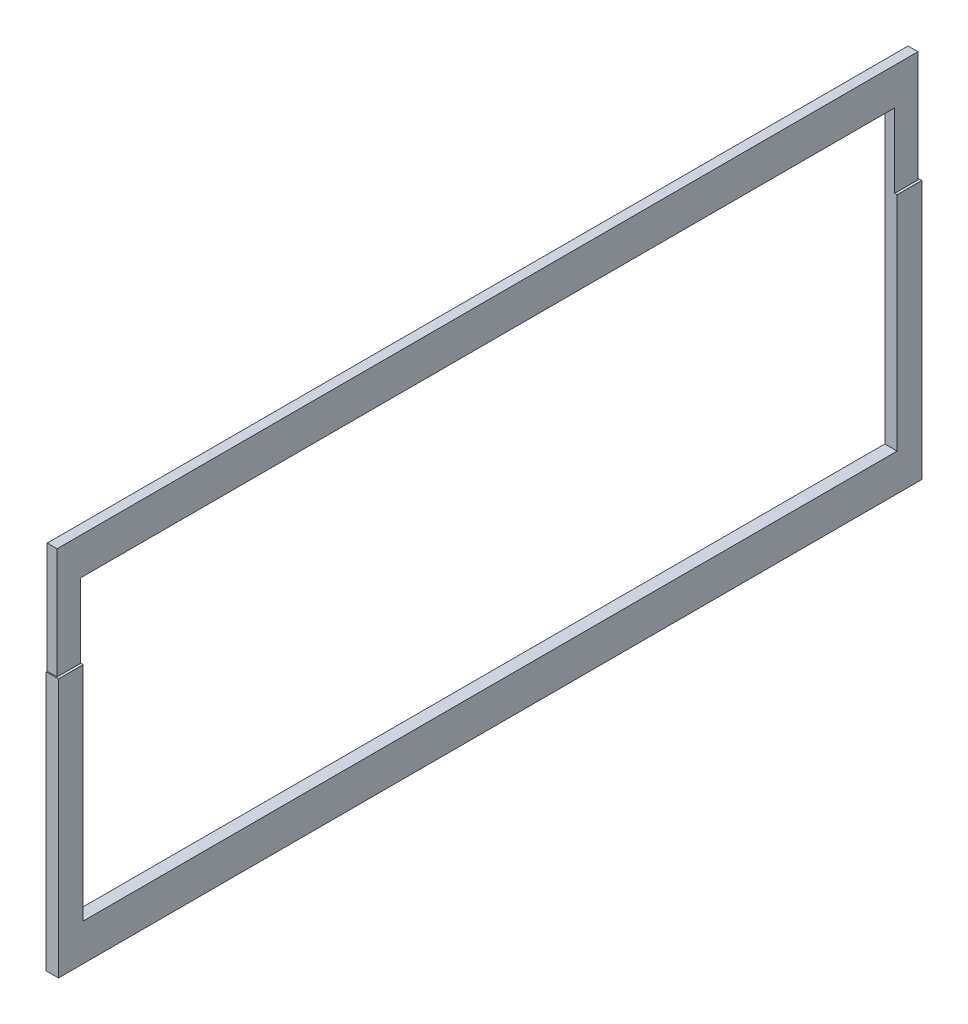
from build123d import *

# Parameters (mm, degrees)
SALIENTE_EXTRUIR1_DEPTH = 10
CROQUIS1_3_W            = 698
CROQUIS1_3_H            = 90
SALIENTE_EXTRUIR2_DEPTH = 8
CROQUIS2_W              = 660
CROQUIS2_H              = 240
CORTAR_EXTRUIR1_DEPTH   = 10


with BuildPart() as part:
    # Croquis1 → Saliente-Extruir1 (new body)
    with BuildSketch(Plane(origin=(0, 0, 0), x_dir=(0, 0, -1), z_dir=(1, 0, 0))):
        Polygon((349, -45), (-349, -45), (-349.868447372, -45), (-349.868447372, -255), (350.131552628, -255), (350.131552628, -45), align=None)
    extrude(amount=SALIENTE_EXTRUIR1_DEPTH)

    # Croquis1<3> → Saliente-Extruir2 (add)
    with BuildSketch(Plane(origin=(0, 0, 0), x_dir=(0, 0, -1), z_dir=(1, 0, 0))):
        Rectangle(CROQUIS1_3_W, CROQUIS1_3_H)
    extrude(amount=SALIENTE_EXTRUIR2_DEPTH)

    # Croquis2 → Cortar-Extruir1 (cut)
    with BuildSketch(Plane.ZY):
        with Locations((-0.131552628, -105)):
            Rectangle(CROQUIS2_W, CROQUIS2_H)
    extrude(amount=-CORTAR_EXTRUIR1_DEPTH, mode=Mode.SUBTRACT)


solid = part.part
